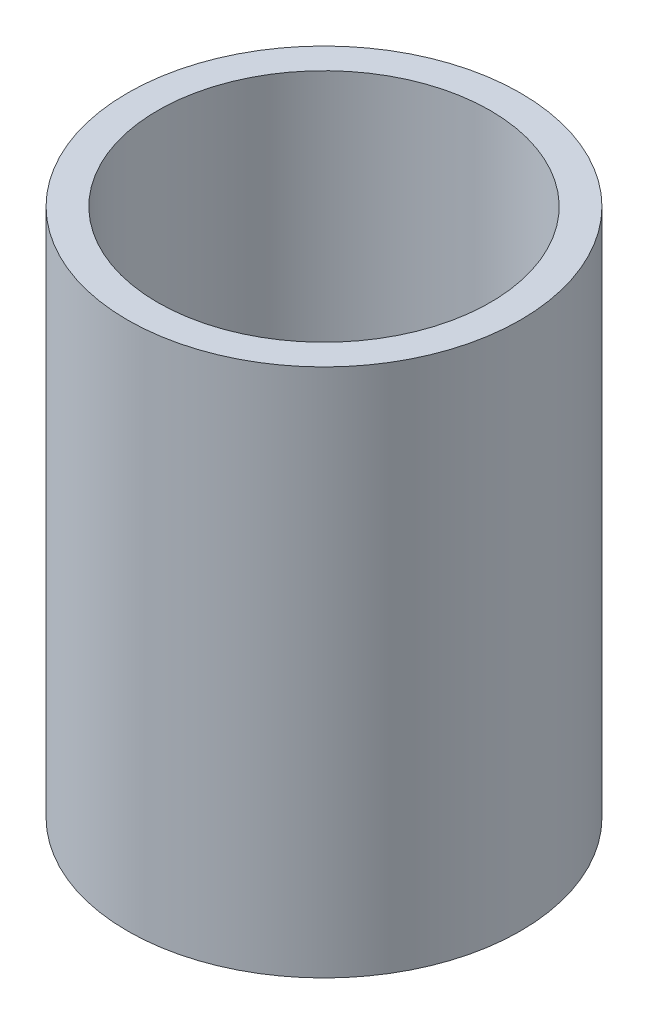
from build123d import *

# Parameters (mm, degrees)
SKETCH1_R           = 52
BOSS_EXTRUDE1_DEPTH = 140
SHELL1_T            = 8
CUT_EXTRUDE1_START  = -40
SKETCH3_R           = 44
CUT_EXTRUDE1_DEPTH  = 40


with BuildPart() as part:
    # Sketch1 → Boss-Extrude1 (new body)
    with BuildSketch(Plane(origin=(0, 0, 0), x_dir=(1, 0, 0), z_dir=(0, 1, 0))):
        with Locations(Location((0, 0, 0), (0, 0, 270))):
            Circle(SKETCH1_R)
    extrude(amount=BOSS_EXTRUDE1_DEPTH)

    # Shell1 (no face opened: a closed hollow body)
    add(offset(amount=-SHELL1_T, mode=Mode.PRIVATE), mode=Mode.SUBTRACT)

    # Sketch3 → Cut-Extrude1 (cut)
    with BuildSketch(Plane(origin=(0, 140, 0), x_dir=(1, 0, 0), z_dir=(0, 1, 0)).offset(CUT_EXTRUDE1_START)):
        with Locations(Location((0, 0, 0), (0, 0, 270))):
            Circle(SKETCH3_R)
    extrude(amount=CUT_EXTRUDE1_DEPTH, mode=Mode.SUBTRACT)


solid = part.part
